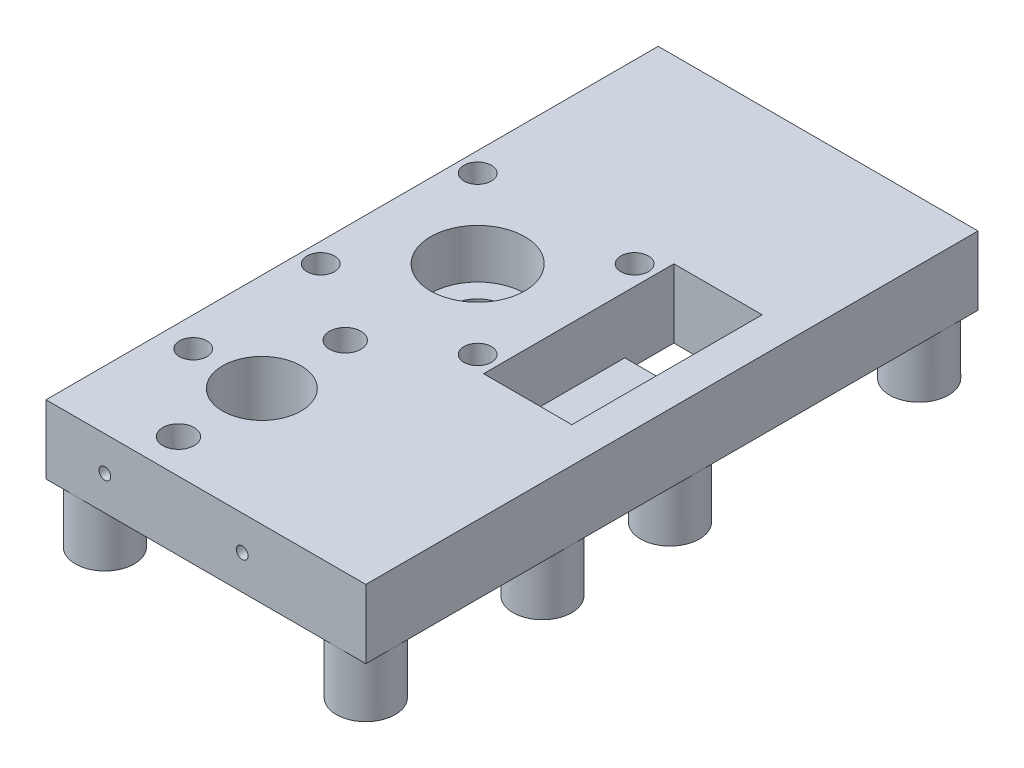
from build123d import *

# Parameters (mm, degrees)
SKETCH_1_W          = 16.3
SKETCH_1_H          = 31.2
SKETCH_1_W_2        = 4.5
SKETCH_1_H_2        = 9.7
EXTRUDE_1_DEPTH     = 3.5
SKETCH_1_16_W       = 4.5
SKETCH_1_16_H       = 7.2
EXTRUDE_3_DEPTH     = 0.6
SKETCH_1_3_R        = 1.35
CUT_EXTRUDE_1_DEPTH = 21.710866713
CUT_EXTRUDE_START   = 1
SKETCH_1_4_R        = 2.4
SKETCH_1_4_R_2      = 1.35
CUT_EXTRUDE_2_DEPTH = 2.5
SKETCH_1_7_R        = 0.7
CUT_EXTRUDE_3_DEPTH = 21.710866713
SKETCH_1_8_R        = 0.95
CUT_EXTRUDE_4_DEPTH = 2
SKETCH_1_10_R       = 2
SKETCH_1_10_R_2     = 0.8
SKETCH_1_10_R_3     = 0.7
CUT_EXTRUDE_5_DEPTH = 21.710866713
SKETCH_1_11_R       = 1
CUT_EXTRUDE_6_DEPTH = 2
CUT_EXTRUDE_START_2 = -3.5
SKETCH_3_R          = 2.55
SKETCH_3_R_2        = 1.05
CUT_EXTRUDE_7_DEPTH = 2.5
SKETCH_1_12_R       = 1.5
EXTRUDE_2_DEPTH     = 3
CUT_EXTRUDE_START_3 = -3
SKETCH_1_13_R       = 0.3
CUT_EXTRUDE_8_DEPTH = 1.5
SKETCH_6_R          = 0.3
CUT_EXTRUDE_9_DEPTH = 2


with BuildPart() as part:
    # 草图1 → 凸台-拉伸1 (new body)
    with BuildSketch(Plane(origin=(0, 0, 0), x_dir=(1, 0, 0), z_dir=(0, 1, 0))):
        with Locations((3.15, -1.4)):
            Rectangle(SKETCH_1_W, SKETCH_1_H)
        with Locations((7.25, 0.15)):
            Rectangle(SKETCH_1_W_2, SKETCH_1_H_2, mode=Mode.SUBTRACT)
    extrude(amount=EXTRUDE_1_DEPTH)

    # 草图1<3> → 切除-拉伸1 (cut, through all)
    with BuildSketch(Plane(origin=(0, 0, 0), x_dir=(1, 0, 0), z_dir=(0, 1, 0))):
        with Locations(Location((0, 0, 0), (0, 0, 270))):
            Circle(SKETCH_1_3_R)
    extrude(amount=CUT_EXTRUDE_1_DEPTH, mode=Mode.SUBTRACT)

    # 草图1<4> → 切除-拉伸2 (cut)
    with BuildSketch(Plane(origin=(0, 0, 0), x_dir=(1, 0, 0), z_dir=(0, 1, 0)).offset(CUT_EXTRUDE_START)):
        with Locations(Location((0, 0, 0), (0, 0, 270))):
            Circle(SKETCH_1_4_R)
        with Locations(Location((0, 0, 0), (0, 0, 270))):
            Circle(SKETCH_1_4_R_2, mode=Mode.SUBTRACT)
    extrude(amount=CUT_EXTRUDE_2_DEPTH, mode=Mode.SUBTRACT)

    # 草图1<7> → 切除-拉伸3 (cut, through all)
    with BuildSketch(Plane(origin=(0, 0, 0), x_dir=(1, 0, 0), z_dir=(0, 1, 0))):
        with Locations(Location((4, 4, 0), (0, 0, 270))):
            Circle(SKETCH_1_7_R)
        with Locations(Location((-4, -4, 0), (0, 0, 270))):
            Circle(SKETCH_1_7_R)
        with Locations(Location((-4, 4, 0), (0, 0, 270))):
            Circle(SKETCH_1_7_R)
        with Locations(Location((4, -4, 0), (0, 0, 270))):
            Circle(SKETCH_1_7_R)
    extrude(amount=CUT_EXTRUDE_3_DEPTH, mode=Mode.SUBTRACT)

    # 草图1<8> → 切除-拉伸4 (cut)
    with BuildSketch(Plane(origin=(0, 0, 0), x_dir=(1, 0, 0), z_dir=(0, 1, 0))):
        with Locations(Location((4, 4, 0), (0, 0, 270))):
            Circle(SKETCH_1_8_R)
        with Locations(Location((-4, -4, 0), (0, 0, 270))):
            Circle(SKETCH_1_8_R)
        with Locations(Location((-4, 4, 0), (0, 0, 270))):
            Circle(SKETCH_1_8_R)
        with Locations(Location((4, -4, 0), (0, 0, 270))):
            Circle(SKETCH_1_8_R)
    extrude(amount=CUT_EXTRUDE_4_DEPTH, mode=Mode.SUBTRACT)

    # 草图1<10> → 切除-拉伸5 (cut, through all)
    with BuildSketch(Plane(origin=(0, 0, 0), x_dir=(1, 0, 0), z_dir=(0, 1, 0))):
        with Locations(Location((0, -11, 0), (0, 0, 270))):
            Circle(SKETCH_1_10_R)
        with Locations(Location((0, -6.75, 0), (0, 0, 270))):
            Circle(SKETCH_1_10_R_2)
        with Locations(Location((0, -15.25, 0), (0, 0, 270))):
            Circle(SKETCH_1_10_R_2)
        with Locations(Location((-3.5, -11, 0), (0, 0, 270))):
            Circle(SKETCH_1_10_R_3)
    extrude(amount=CUT_EXTRUDE_5_DEPTH, mode=Mode.SUBTRACT)

    # 草图1<11> → 切除-拉伸6 (cut)
    with BuildSketch(Plane(origin=(0, 0, 0), x_dir=(1, 0, 0), z_dir=(0, 1, 0))):
        with Locations(Location((0, -6.75, 0), (0, 0, 270))):
            Circle(SKETCH_1_11_R)
        with Locations(Location((0, -15.25, 0), (0, 0, 270))):
            Circle(SKETCH_1_11_R)
        with Locations(Location((-3.5, -11, 0), (0, 0, 270))):
            Circle(SKETCH_1_11_R)
    extrude(amount=CUT_EXTRUDE_6_DEPTH, mode=Mode.SUBTRACT)

    # 草图3 → 切除-拉伸7 (cut)
    with BuildSketch(Plane(origin=(0, 3.5, 0), x_dir=(1, 0, 0), z_dir=(0, 1, 0)).offset(CUT_EXTRUDE_START_2)):
        with Locations(Location((4.7, -11, 0), (0, 0, 270))):
            Circle(SKETCH_3_R)
        with Locations(Location((5.25646039, 8.152277238, 0), (0, 0, 270))):
            Circle(SKETCH_3_R_2)
    extrude(amount=CUT_EXTRUDE_7_DEPTH, mode=Mode.SUBTRACT)

    # 草图1<12> → 凸台-拉伸2 (add)
    with BuildSketch(Plane(origin=(0, 0, 0), x_dir=(1, 0, 0), z_dir=(0, 1, 0))):
        with Locations(Location((-3.5, -15.5, 0), (0, 0, 270))):
            Circle(SKETCH_1_12_R)
        with Locations(Location((9.8, -15.5, 0), (0, 0, 270))):
            Circle(SKETCH_1_12_R)
        with Locations(Location((9.8, -6.5, 0), (0, 0, 270))):
            Circle(SKETCH_1_12_R)
        with Locations(Location((-3.5, 12.7, 0), (0, 0, 270))):
            Circle(SKETCH_1_12_R)
        with Locations(Location((9.8, 12.7, 0), (0, 0, 270))):
            Circle(SKETCH_1_12_R)
        with Locations(Location((-3.5, 6.5, 0), (0, 0, 270))):
            Circle(SKETCH_1_12_R)
        with Locations(Location((9.8, 0, 0), (0, 0, 270))):
            Circle(SKETCH_1_12_R)
    extrude(amount=-EXTRUDE_2_DEPTH)

    # 草图1<13> → 切除-拉伸8 (cut)
    with BuildSketch(Plane(origin=(0, 0, 0), x_dir=(1, 0, 0), z_dir=(0, 1, 0)).offset(CUT_EXTRUDE_START_3)):
        with Locations(Location((-3.5, -15.5, 0), (0, 0, 270))):
            Circle(SKETCH_1_13_R)
        with Locations(Location((9.8, -6.5, 0), (0, 0, 270))):
            Circle(SKETCH_1_13_R)
        with Locations(Location((9.8, -15.5, 0), (0, 0, 270))):
            Circle(SKETCH_1_13_R)
        with Locations(Location((-3.5, 12.7, 0), (0, 0, 270))):
            Circle(SKETCH_1_13_R)
        with Locations(Location((9.8, 12.7, 0), (0, 0, 270))):
            Circle(SKETCH_1_13_R)
        with Locations(Location((-3.5, 6.5, 0), (0, 0, 270))):
            Circle(SKETCH_1_13_R)
        with Locations(Location((9.8, 0, 0), (0, 0, 270))):
            Circle(SKETCH_1_13_R)
    extrude(amount=CUT_EXTRUDE_8_DEPTH, mode=Mode.SUBTRACT)

    # 草图6 → 切除-拉伸9 (cut)
    with BuildSketch(Plane.XY.offset(17)):
        with Locations((-2, 1.75)):
            Circle(SKETCH_6_R)
        with Locations((5, 1.75)):
            Circle(SKETCH_6_R)
    extrude(amount=-CUT_EXTRUDE_9_DEPTH, mode=Mode.SUBTRACT)


with BuildPart() as body_2:
    # 草图1<16> → 凸台-拉伸3 (new body)
    with BuildSketch(Plane(origin=(0, 0, 0), x_dir=(1, 0, 0), z_dir=(0, 1, 0))):
        with Locations((7.25, -1.1)):
            Rectangle(SKETCH_1_16_W, SKETCH_1_16_H)
    extrude(amount=EXTRUDE_3_DEPTH)


solid = Compound([part.part, body_2.part])
